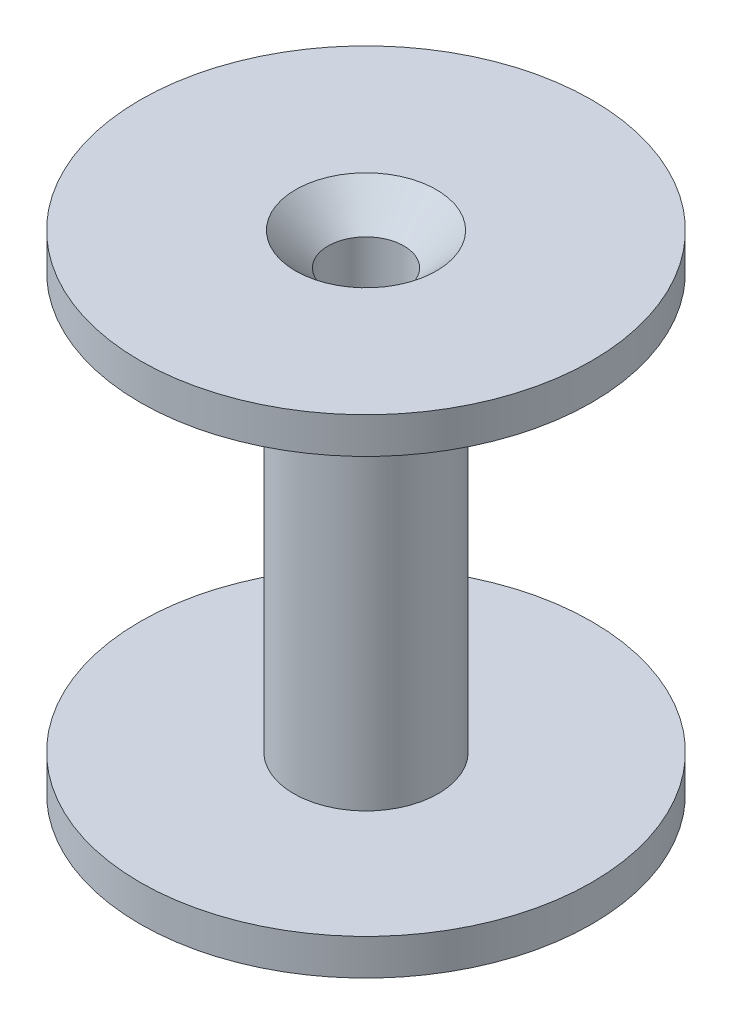
from build123d import *


with BuildPart() as part:
    # Sketch1 → Revolve1 (revolve)
    with BuildSketch(Plane(origin=(0, 0, 0), x_dir=(0, 0, -1), z_dir=(1, 0, 0))):
        Polygon((-4, 11.5), (-4, -11.5), (-12.5, -11.5), (-12.5, -13.5), (-2.1, -13.5), (-2.1, 11.701863459), (-3.898136541, 13.5), (-12.5, 13.5), (-12.5, 11.5), align=None)
    revolve(axis=Axis((0, 40.378378378, 0), (0, -1, 0)))


solid = part.part
